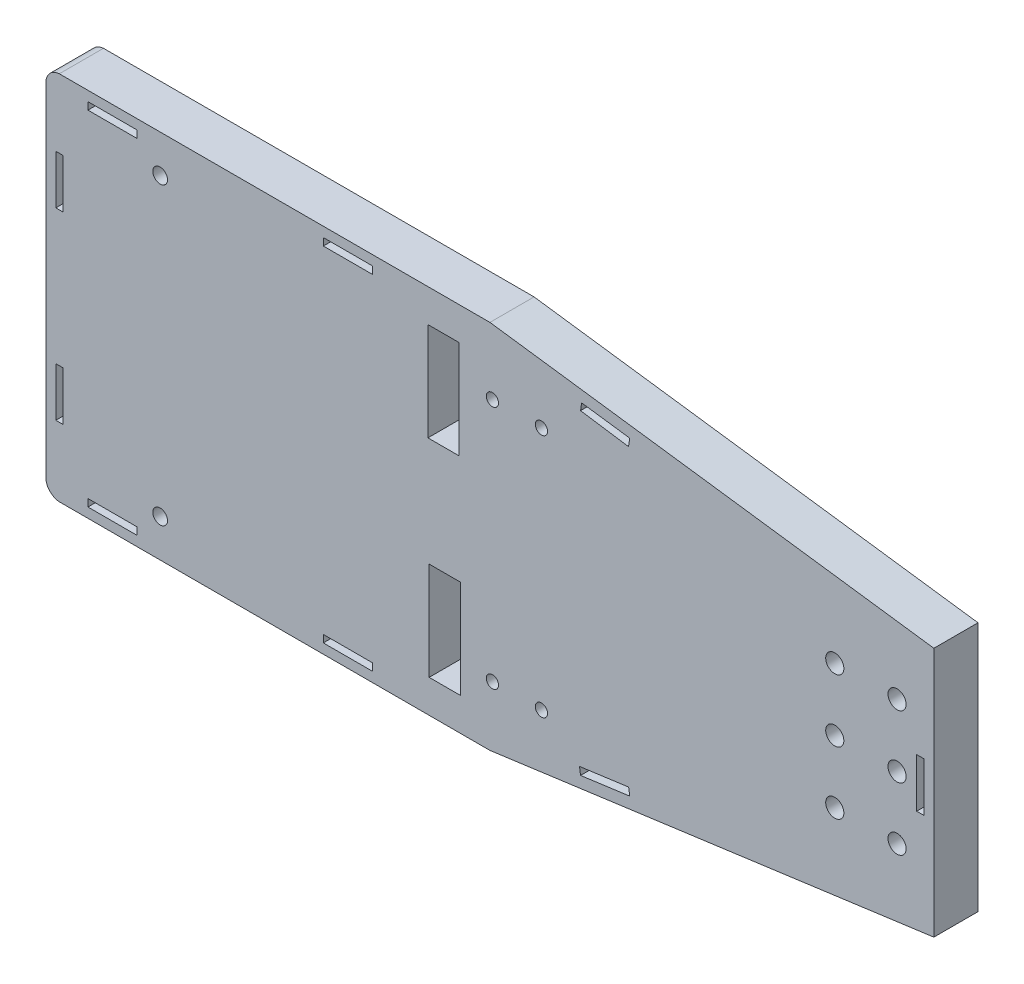
from build123d import *

# Parameters (mm, degrees)
SKETCH1_W           = 181
SKETCH1_H           = 75.57
BOSS_EXTRUDE2_DEPTH = 9
SKETCH6_W           = 1.5
SKETCH6_H           = 10
SKETCH6_R           = 1.85
SKETCH6_R_2         = 1.25
SKETCH6_W_2         = 6.368125956
SKETCH6_H_2         = 20
SKETCH6_W_3         = 6.368125955
SKETCH6_W_4         = 10
SKETCH6_H_3         = 1.5
SKETCH6_R_3         = 1.5
CUT_EXTRUDE7_DEPTH  = 9


with BuildPart() as part:
    # Sketch1 → Boss-Extrude2 (new body)
    with BuildSketch(Plane.XY):
        Rectangle(SKETCH1_W, SKETCH1_H)
    extrude(amount=BOSS_EXTRUDE2_DEPTH)

    # Sketch6 → Cut-Extrude7 (cut)
    with BuildSketch(Plane.XY.offset(9)):
        Polygon((90.5, -25.503407437), (0, -37.785), (90.5, -37.785), align=None)
        Polygon((90.5, 37.785), (0, 37.785), (90.5, 25.503407437), align=None)
        with Locations((87.75, -0.017122468)):
            Rectangle(SKETCH6_W, SKETCH6_H)
        with Locations((83, 0)):
            Circle(SKETCH6_R)
        with Locations((83, -12.753407437)):
            Circle(SKETCH6_R)
        with Locations((70.3, -12.753407437)):
            Circle(SKETCH6_R)
        with Locations((70.3, 0)):
            Circle(SKETCH6_R)
        with Locations((70.3, 12.753407437)):
            Circle(SKETCH6_R)
        with Locations((83, 12.753407437)):
            Circle(SKETCH6_R)
        Polygon((18.699571513, 32.929403247), (28.501771515, 31.599164279), (28.260126082, 29.976752052), (18.476794857, 31.446038639), align=None)
        with Locations((10.504840582, 24.4)):
            Circle(SKETCH6_R_2)
        with Locations((0.504840582, 24.4)):
            Circle(SKETCH6_R_2)
        with Locations((-9.454971277, 21.080969171)):
            Rectangle(SKETCH6_W_2, SKETCH6_H_2)
        with Locations((-9.205288194, -21.08)):
            Rectangle(SKETCH6_W_3, SKETCH6_H_2)
        with Locations((0.504840582, -25.4)):
            Circle(SKETCH6_R_2)
        with Locations((10.504840582, -25.4)):
            Circle(SKETCH6_R_2)
        Polygon((18.472571869, -32.963494813), (28.501771515, -31.60245013), (28.279412419, -30.118876563), (18.270858535, -31.477119446), align=None)
        with Locations((-28.962631903, 35.035)):
            Rectangle(SKETCH6_W_4, SKETCH6_H_3)
        with Locations((-76.947155779, 35.035)):
            Rectangle(SKETCH6_W_4, SKETCH6_H_3)
        with Locations((-67.23, 30.095)):
            Circle(SKETCH6_R_3)
        with BuildLine():
            Line((-90.5, 37.785), (-90.5, 35.274795088))
            ThreePointArc((-90.5, 35.274795088), (-89.587457665, 37.010103297), (-87.786468161, 37.785))
            Line((-87.786468161, 37.785), (-90.5, 37.785))
        make_face()
        with Locations((-87.75, 18.75)):
            Rectangle(SKETCH6_W, SKETCH6_H)
        with Locations((-87.75, -18.75)):
            Rectangle(SKETCH6_W, SKETCH6_H)
        with BuildLine():
            ThreePointArc((-87.786468161, -37.785), (-89.587457665, -37.010103297), (-90.5, -35.274795088))
            Line((-90.5, -35.274795088), (-90.5, -37.785))
            Line((-90.5, -37.785), (-87.786468161, -37.785))
        make_face()
        with Locations((-76.947155779, -35.035)):
            Rectangle(SKETCH6_W_4, SKETCH6_H_3)
        with Locations((-67.23, -30.095)):
            Circle(SKETCH6_R_3)
        with Locations((-28.962631903, -35.035)):
            Rectangle(SKETCH6_W_4, SKETCH6_H_3)
    extrude(amount=-CUT_EXTRUDE7_DEPTH, mode=Mode.SUBTRACT)


solid = part.part
